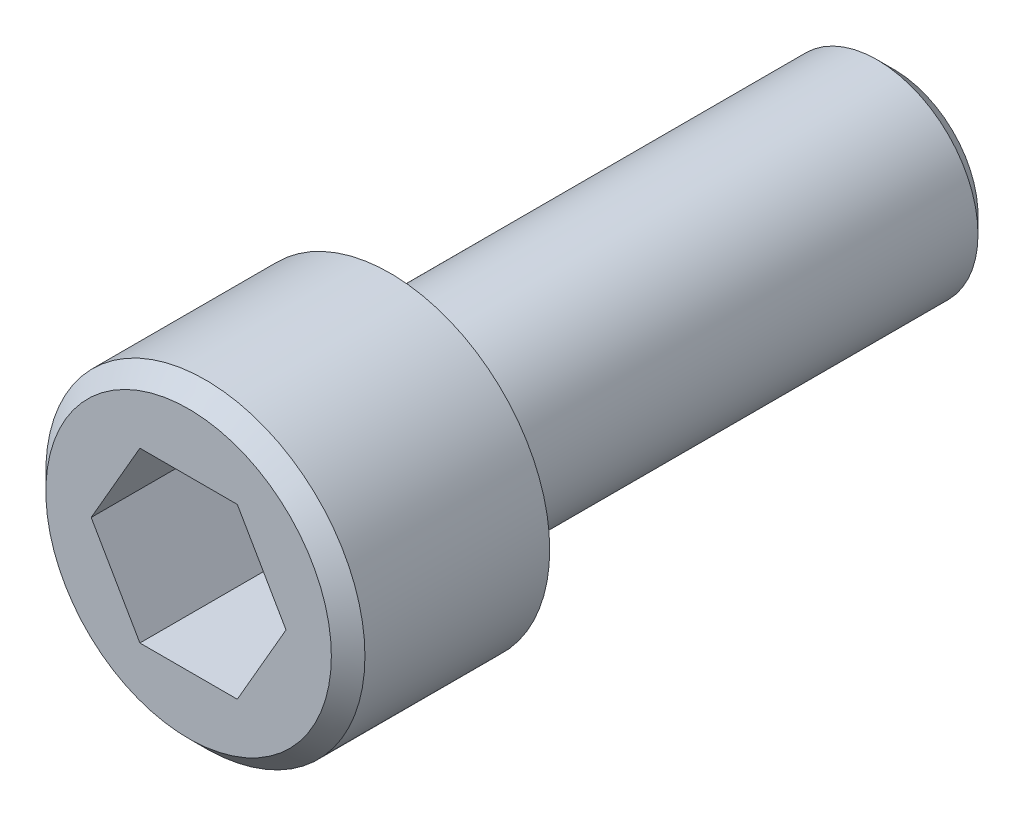
from build123d import *

# Parameters (mm, degrees)
CROQUIS1_R              = 9.5
SALIENTE_EXTRUIR1_DEPTH = 12
CROQUIS2_R              = 6
SALIENTE_EXTRUIR2_DEPTH = 30
CHAFL_N1_SIZE           = 1
CORTAR_EXTRUIR1_DEPTH   = 8


with BuildPart() as part:
    # Croquis1 → Saliente-Extruir1 (new body)
    with BuildSketch(Plane.XY):
        Circle(CROQUIS1_R)
    extrude(amount=SALIENTE_EXTRUIR1_DEPTH)

    # Croquis2 → Saliente-Extruir2 (add)
    with BuildSketch(Plane(origin=(0, 0, 0), x_dir=(-1, 0, 0), z_dir=(0, 0, -1))):
        with Locations(Location((0, 0, 0), (0, 0, 180))):
            Circle(CROQUIS2_R)
    extrude(amount=SALIENTE_EXTRUIR2_DEPTH)

    # Chaflán1
    chafl_n1_edges = [part.edges().sort_by_distance(p)[0] for p in [
        (-9.5, 0, 12),
        (-6, 0, -30),
    ]]
    chamfer(chafl_n1_edges, length=CHAFL_N1_SIZE)

    # Croquis3 → Cortar-Extruir1 (cut)
    with BuildSketch(Plane.XY.offset(12)):
        Polygon((5.8, 0), (2.9, 5.022947342), (-2.9, 5.022947342), (-5.8, 0), (-2.9, -5.022947342), (2.9, -5.022947342), align=None)
    extrude(amount=-CORTAR_EXTRUIR1_DEPTH, mode=Mode.SUBTRACT)


solid = part.part
